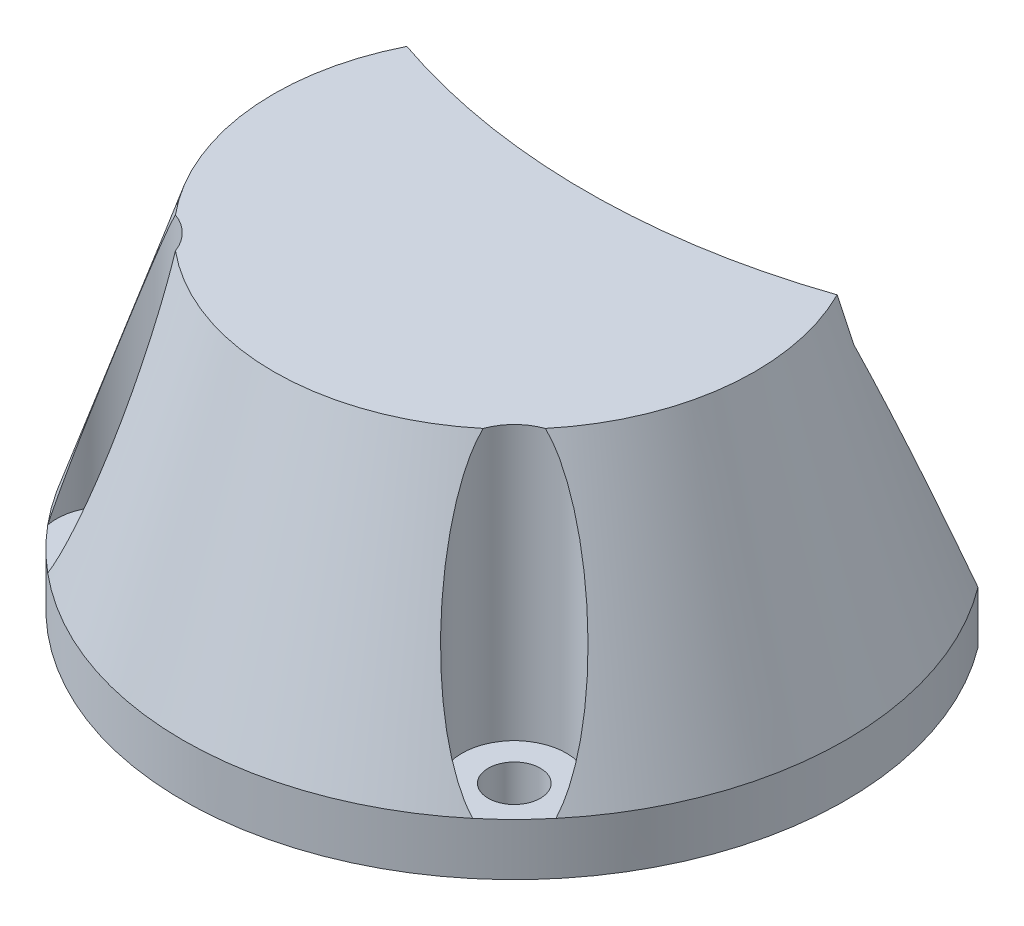
from build123d import *

# Parameters (mm, degrees)
SKETCH5_R          = 2
CUT_EXTRUDE2_DEPTH = 44.764369069
SKETCH6_R          = 4
CUT_EXTRUDE3_DEPTH = 22
SKETCH7_R          = 4.5
CUT_EXTRUDE4_DEPTH = 22
CUT_EXTRUDE5_DEPTH = 22
CUT_EXTRUDE6_DEPTH = 44.764369185


with BuildPart() as part:
    # Sketch2 → Revolve1 (revolve)
    with BuildSketch(Plane(origin=(0, 0, 0), x_dir=(0, 0, -1), z_dir=(1, 0, 0))):
        Polygon((-18.45, 25), (-25.4, 4), (-25.4, 0), (-15, 0), (-15, 22), (0, 22), (0, 25), align=None)
    revolve(axis=Axis((0, 0, 0), (0, 1, 0)))

    # Sketch5 → Cut-Extrude2 (cut, through all)
    with BuildSketch(Plane(origin=(0, 25, 0), x_dir=(1, 0, 0), z_dir=(0, 1, 0))):
        with Locations((-15.556349186, -15.556349186)):
            Circle(SKETCH5_R)
        with Locations((15.556349186, -15.556349186)):
            Circle(SKETCH5_R)
    extrude(amount=-CUT_EXTRUDE2_DEPTH, mode=Mode.SUBTRACT)

    # Sketch6 → Cut-Extrude3 (cut)
    with BuildSketch(Plane(origin=(0, 4, 0), x_dir=(-1, 0, 0), z_dir=(0, -1, 0))):
        with Locations((15.556349186, -15.556349186)):
            Circle(SKETCH6_R)
        with Locations((-15.556349186, -15.556349186)):
            Circle(SKETCH6_R)
    extrude(amount=-CUT_EXTRUDE3_DEPTH, mode=Mode.SUBTRACT)

    # Sketch7 → Cut-Extrude4 (cut)
    with BuildSketch(Plane(origin=(0, 0, 0), x_dir=(-1, 0, 0), z_dir=(0, -1, 0))):
        with Locations((15.556349186, 15.556349186)):
            Circle(SKETCH7_R)
        with Locations((-15.556349186, 15.556349186)):
            Circle(SKETCH7_R)
    extrude(amount=-CUT_EXTRUDE4_DEPTH, mode=Mode.SUBTRACT)

    # Sketch10 → Cut-Extrude5 (cut)
    with BuildSketch(Plane.XZ):
        with BuildLine():
            Line((-14.704067619, 2.964860106), (-16.680641023, -6.837851641))
            Line((-16.680641023, -6.837851641), (-20.322553732, -15.236594429))
            ThreePointArc((-20.322553732, -15.236594429), (-17.924840594, -17.996113183), (-15.155828757, -20.382856883))
            ThreePointArc((-15.155828757, -20.382856883), (0, -25.4), (15.155828757, -20.382856883))
            ThreePointArc((15.155828757, -20.382856883), (17.924840594, -17.996113183), (20.322553732, -15.236594429))
            Line((20.322553732, -15.236594429), (16.680641023, -6.837851641))
            Line((16.680641023, -6.837851641), (14.704067619, 2.964860106))
            ThreePointArc((14.704067619, 2.964860106), (0, 15), (-14.704067619, 2.964860106))
        make_face()
    extrude(amount=-CUT_EXTRUDE5_DEPTH, mode=Mode.SUBTRACT)

    # Sketch14 → Cut-Extrude6 (cut, through all)
    with BuildSketch(Plane(origin=(0, 25, 0), x_dir=(1, 0, 0), z_dir=(0, 1, 0))):
        with BuildLine():
            ThreePointArc((17.441336231, 8.592117572), (0, 19.442857143), (-17.441336231, 8.592117572))
            ThreePointArc((-17.441336231, 8.592117572), (0, 5.504168361), (17.441336231, 8.592117572))
        make_face()
    extrude(amount=-CUT_EXTRUDE6_DEPTH, mode=Mode.SUBTRACT)


solid = part.part
